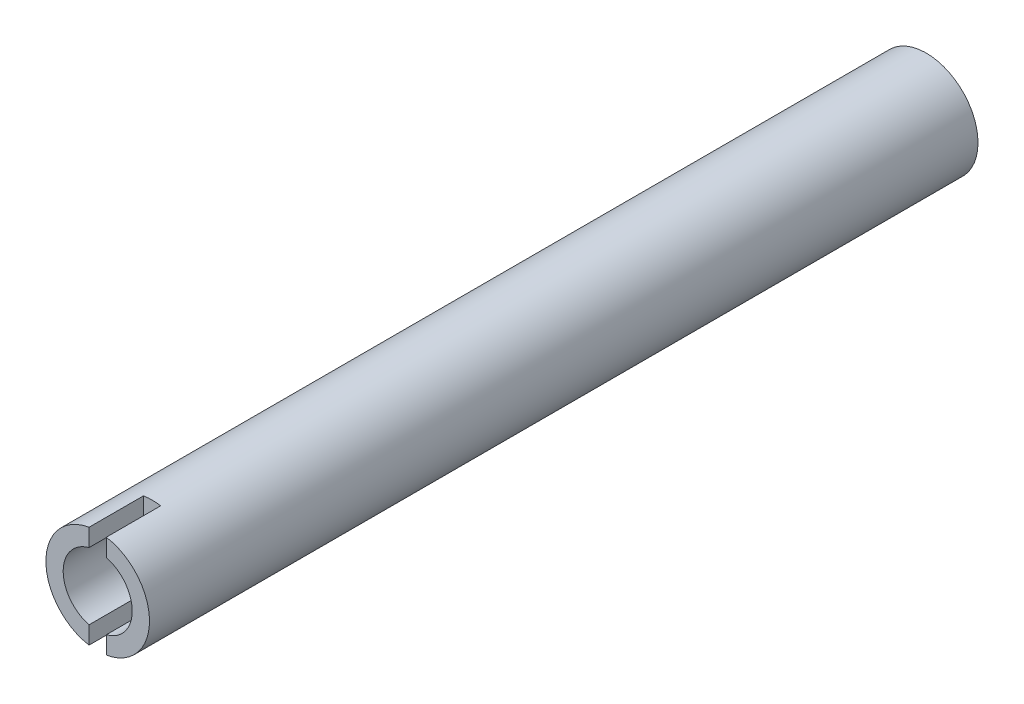
from build123d import *

# Parameters (mm, degrees)
SKETCH1_R           = 9.525
SKETCH1_R_2         = 6.35
BOSS_EXTRUDE1_DEPTH = 152.4
SKETCH2_W           = 3.175
SKETCH2_H           = 25.179063452
CUT_EXTRUDE1_DEPTH  = 10


with BuildPart() as part:
    # Sketch1 → Boss-Extrude1 (new body)
    with BuildSketch(Plane.XY):
        Circle(SKETCH1_R)
        Circle(SKETCH1_R_2, mode=Mode.SUBTRACT)
    extrude(amount=BOSS_EXTRUDE1_DEPTH)

    # Sketch2 → Cut-Extrude1 (cut)
    with BuildSketch(Plane.XY.offset(152.4)):
        Rectangle(SKETCH2_W, SKETCH2_H)
    extrude(amount=-CUT_EXTRUDE1_DEPTH, mode=Mode.SUBTRACT)


solid = part.part
